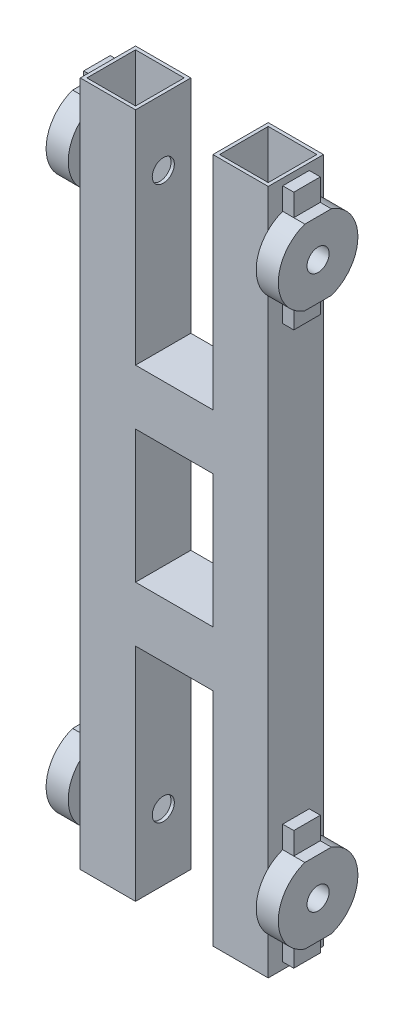
from build123d import *

# Parameters (mm, degrees)
SKETCH1_W           = 25
SKETCH1_H           = 25
SKETCH1_W_2         = 22
SKETCH1_H_2         = 22
BOSS_EXTRUDE1_DEPTH = 310
SKETCH2_W           = 25
SKETCH2_H           = 25
SKETCH2_W_2         = 22
SKETCH2_H_2         = 22
BOSS_EXTRUDE2_DEPTH = 17.5
SKETCH8_R           = 5
CUT_EXTRUDE1_DEPTH  = 25
SKETCH9_R           = 18
SKETCH9_R_2         = 5
BOSS_EXTRUDE3_DEPTH = 10
SKETCH10_R          = 18
SKETCH10_R_2        = 5
BOSS_EXTRUDE4_DEPTH = 10
SKETCH11_W          = 12
SKETCH11_H          = 10
CUT_EXTRUDE2_DEPTH  = 5


with BuildPart() as part:
    # Sketch1 → Boss-Extrude1 (new body)
    with BuildSketch(Plane(origin=(0, 0, 0), x_dir=(1, 0, 0), z_dir=(0, 1, 0))):
        with Locations((30.5, -0.057992327)):
            Rectangle(SKETCH1_W, SKETCH1_H)
        with Locations((30.5, -0.057992327)):
            Rectangle(SKETCH1_W_2, SKETCH1_H_2, mode=Mode.SUBTRACT)
    boss_extrude1 = extrude(amount=BOSS_EXTRUDE1_DEPTH)

    # Sketch2 → Boss-Extrude2 (add)
    # profile 1 of 2: a face of its own
    with BuildSketch(Plane.ZY.offset(-18)):
        with Locations((0.057992327, 197.5)):
            Rectangle(SKETCH2_W, SKETCH2_H)
        with Locations((0.057992327, 197.5)):
            Rectangle(SKETCH2_W_2, SKETCH2_H_2, mode=Mode.SUBTRACT)
    # profile 2 of 2: a face of its own
    with BuildSketch(Plane.ZY.offset(-18)):
        with Locations((0.057992327, 112.5)):
            Rectangle(SKETCH2_W, SKETCH2_H)
        with Locations((0.057992327, 112.5)):
            Rectangle(SKETCH2_W_2, SKETCH2_H_2, mode=Mode.SUBTRACT)
    boss_extrude2 = extrude(amount=BOSS_EXTRUDE2_DEPTH)

    # Sketch8 → Cut-Extrude1 (cut)
    with BuildSketch(Plane.ZY.offset(-18)):
        with Locations((0, 280)):
            Circle(SKETCH8_R)
        with Locations((0, 30)):
            Circle(SKETCH8_R)
    cut_extrude1 = extrude(amount=-CUT_EXTRUDE1_DEPTH, mode=Mode.SUBTRACT)

    # Sketch9 → Boss-Extrude3 (add)
    # profile 1 of 3: a face of its own
    with BuildSketch(Plane(origin=(43, 0, 0), x_dir=(0, 0, -1), z_dir=(1, 0, 0))):
        with Locations((0, 30)):
            Circle(SKETCH9_R)
        with Locations(Location((0, 30, 0), (0, 0, 180))):
            Circle(SKETCH9_R_2, mode=Mode.SUBTRACT)
    # profile 2 of 3: a face of its own
    with BuildSketch(Plane(origin=(43, 0, 0), x_dir=(0, 0, -1), z_dir=(1, 0, 0))):
        with BuildLine():
            Line((-6, 13.029437252), (-6, 3.029437252))
            Line((-6, 3.029437252), (6, 3.029437252))
            Line((6, 3.029437252), (6, 13.029437252))
            ThreePointArc((6, 13.029437252), (0, 12), (-6, 13.029437252))
        make_face()
    # profile 3 of 3: a face of its own
    with BuildSketch(Plane(origin=(43, 0, 0), x_dir=(0, 0, -1), z_dir=(1, 0, 0))):
        with BuildLine():
            Line((-6, 46.970562748), (-6, 56.970562748))
            Line((-6, 56.970562748), (6, 56.970562748))
            Line((6, 56.970562748), (6, 46.970562748))
            ThreePointArc((6, 46.970562748), (0, 48), (-6, 46.970562748))
        make_face()
    boss_extrude3 = extrude(amount=BOSS_EXTRUDE3_DEPTH)

    # Sketch10 → Boss-Extrude4 (add)
    # profile 1 of 3: a face of its own
    with BuildSketch(Plane(origin=(43, 0, 0), x_dir=(0, 0, -1), z_dir=(1, 0, 0))):
        with Locations((0, 280)):
            Circle(SKETCH10_R)
        with Locations(Location((0, 280, 0), (0, 0, 180))):
            Circle(SKETCH10_R_2, mode=Mode.SUBTRACT)
    # profile 2 of 3: a face of its own
    with BuildSketch(Plane(origin=(43, 0, 0), x_dir=(0, 0, -1), z_dir=(1, 0, 0))):
        with BuildLine():
            Line((-6, 296.970562748), (-6, 306.970562748))
            Line((-6, 306.970562748), (6, 306.970562748))
            Line((6, 306.970562748), (6, 296.970562748))
            ThreePointArc((6, 296.970562748), (0, 298), (-6, 296.970562748))
        make_face()
    # profile 3 of 3: a face of its own
    with BuildSketch(Plane(origin=(43, 0, 0), x_dir=(0, 0, -1), z_dir=(1, 0, 0))):
        with BuildLine():
            Line((-6, 263.029437252), (-6, 253.029437252))
            Line((-6, 253.029437252), (6, 253.029437252))
            Line((6, 253.029437252), (6, 263.029437252))
            ThreePointArc((6, 263.029437252), (0, 262), (-6, 263.029437252))
        make_face()
    boss_extrude4 = extrude(amount=BOSS_EXTRUDE4_DEPTH)

    # Sketch11 → Cut-Extrude2 (cut)
    with BuildSketch(Plane(origin=(53, 0, 0), x_dir=(0, 0, -1), z_dir=(1, 0, 0))):
        with Locations((0, 8.029437252)):
            Rectangle(SKETCH11_W, SKETCH11_H)
        with Locations((0, 51.970562748)):
            Rectangle(SKETCH11_W, SKETCH11_H)
        with Locations((0, 258.029437252)):
            Rectangle(SKETCH11_W, SKETCH11_H)
        with Locations((0, 301.970562748)):
            Rectangle(SKETCH11_W, SKETCH11_H)
    cut_extrude2 = extrude(amount=-CUT_EXTRUDE2_DEPTH, mode=Mode.SUBTRACT)

    # Mirror1: Boss-Extrude1, Boss-Extrude2, Cut-Extrude1, Boss-Extrude3, Boss-Extrude4, Cut-Extrude2 across plane
    add(boss_extrude1.mirror(Plane.ZY.offset(-0.5)))
    add(boss_extrude2.mirror(Plane.ZY.offset(-0.5)))
    add(cut_extrude1.mirror(Plane.ZY.offset(-0.5)), mode=Mode.SUBTRACT)
    add(boss_extrude3.mirror(Plane.ZY.offset(-0.5)))
    add(boss_extrude4.mirror(Plane.ZY.offset(-0.5)))
    add(cut_extrude2.mirror(Plane.ZY.offset(-0.5)), mode=Mode.SUBTRACT)


solid = part.part
